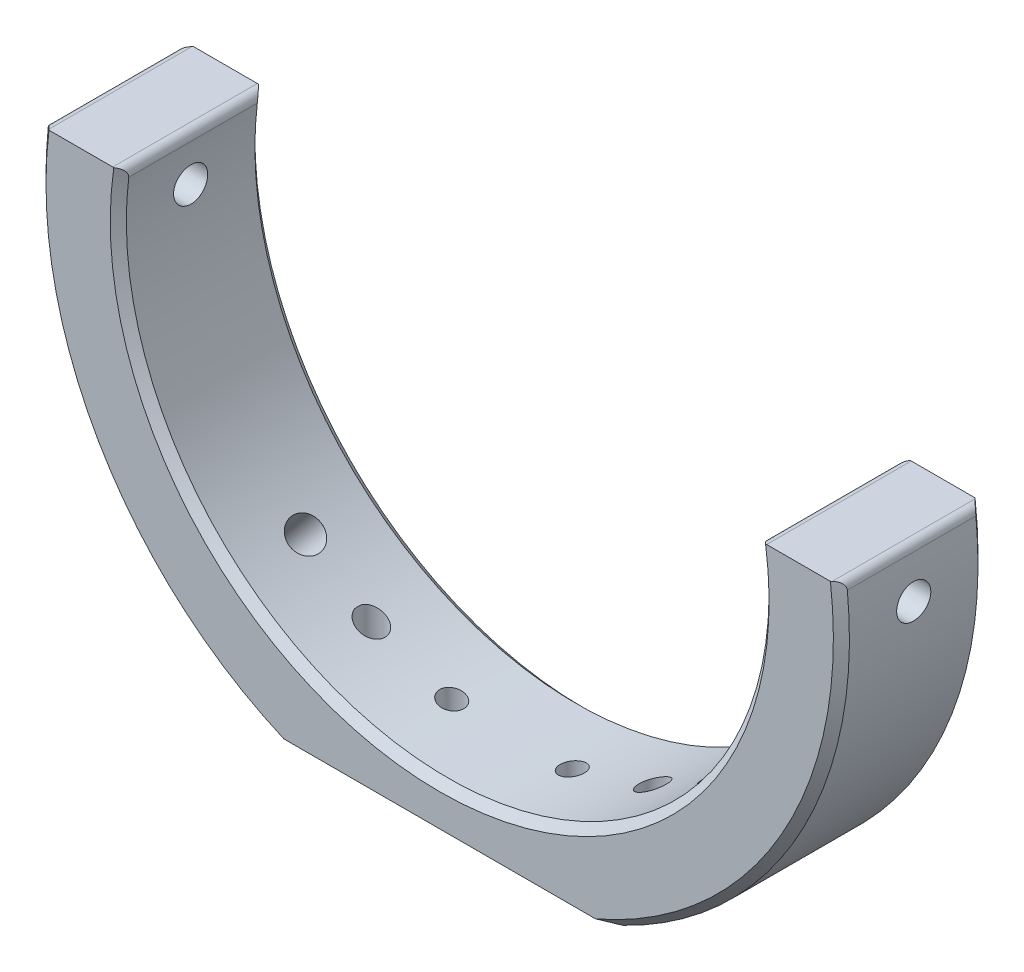
from build123d import *

# Parameters (mm, degrees)
SKETCH_1_R               = 100
SKETCH_1_R_2             = 80
EXTRUDE_1_DEPTH          = 36
CHAMFER_1_SIZE           = 2
CUT_EXTRUDE_1_DEPTH      = 146.931490776
CUT_EXTRUDE_1_DEPTH_BACK = 146.931490776
MM_1_D                   = 6
MM_1_DEPTH               = 19
MM_1_TIP                 = 1.802581857
HOLE_WIZARD_M8_1_D       = 6.8
HOLE_WIZARD_M8_1_DEPTH   = 19.75
HOLE_WIZARD_M8_1_TIP     = 2.042926105
PATTERN_CIRCULAR_1_COUNT = 4
PATTERN_CIRCULAR_1_ANGLE = 240
SKETCH_12_W              = 150
SKETCH_12_H              = 97.553227681
CUT_EXTRUDE_2_DEPTH      = 146.931490913
FILLET_1_R               = 5
HOLE_WIZARD_M10_2_D      = 8.5
SKETCH_15_W              = 235.919366165
SKETCH_15_H              = 63.632835437
CUT_EXTRUDE_3_DEPTH      = 140.269523031
FILLET_2_R               = 2


with BuildPart() as part:
    # 草图1 → 凸台-拉伸1 (new body)
    with BuildSketch(Plane.XY):
        Circle(SKETCH_1_R)
        Circle(SKETCH_1_R_2, mode=Mode.SUBTRACT)
    extrude(amount=EXTRUDE_1_DEPTH)

    # 倒角1
    chamfer_1_edges = [part.edges().sort_by_distance(p)[0] for p in [
        (-80, 0, 0),
        (-100, 0, 0),
        (-80, 0, 36),
        (-100, 0, 36),
    ]]
    chamfer(chamfer_1_edges, length=CHAMFER_1_SIZE)

    # 草图4 → 切除-拉伸1 (cut, two sides: drawn at the far end of the back side and taken through both)
    with BuildSketch(Plane.XY.offset(36).offset(-CUT_EXTRUDE_1_DEPTH_BACK)):
        Polygon((-671.32924466, -90), (-83.687890137, -90), (117.525593009, -90), (705.166947532, -90), (705.166947532, -1265.282709046), (-671.32924466, -1265.282709046), align=None)
    extrude(amount=CUT_EXTRUDE_1_DEPTH + CUT_EXTRUDE_1_DEPTH_BACK, mode=Mode.SUBTRACT)

    # 大小mm 暗销孔1
    with Locations(Plane(origin=(0, -90, 0), x_dir=(-1, 0, 0), z_dir=(0, -1, 0))):
        with Locations((15, -18), (-15, -18)):
            Hole(MM_1_D / 2, depth=MM_1_DEPTH)
            with Locations((0, 0, -(MM_1_DEPTH + MM_1_TIP / 2))):  # 118° drill point
                Cone(0, MM_1_D / 2, MM_1_TIP, mode=Mode.SUBTRACT)

    # M8 螺纹孔1
    with Locations(Plane(origin=(0, -90, 0), x_dir=(-1, 0, 0), z_dir=(0, -1, 0))):
        with Locations((35, -18), (-35, -18)):
            Hole(HOLE_WIZARD_M8_1_D / 2, depth=HOLE_WIZARD_M8_1_DEPTH)
            with Locations((0, 0, -(HOLE_WIZARD_M8_1_DEPTH + HOLE_WIZARD_M8_1_TIP / 2))):  # 118° drill point
                Cone(0, HOLE_WIZARD_M8_1_D / 2, HOLE_WIZARD_M8_1_TIP, mode=Mode.SUBTRACT)

    # 草图10 → M10 螺纹孔1 (revolve, cut)
    with BuildSketch(Plane(origin=(-103.923048454, 60, 18), x_dir=(-0.500000000000001, -0.866025403784438, 0), z_dir=(0, 0, 1))):
        Polygon((0, 0), (0, 42.553657631), (4.25, 40), (4.25, 0), align=None)
    hole_wizard_m10_1 = revolve(axis=Axis((-109.422309768, 63.175, 18), (0.866025403784438, -0.500000000000001, 0)), mode=Mode.SUBTRACT)

    # 阵列(圆周)1: M10 螺纹孔1 ×4 about axis
    pattern_circular_1_axis = Axis((0, 0, 36), (0, 0, 1))
    for i in range(1, PATTERN_CIRCULAR_1_COUNT):
        add(hole_wizard_m10_1.rotate(pattern_circular_1_axis, i * PATTERN_CIRCULAR_1_ANGLE / (PATTERN_CIRCULAR_1_COUNT - 1)), mode=Mode.SUBTRACT)

    # 草图12 → 切除-拉伸2 (cut, through all)
    with BuildSketch(Plane.XY.offset(36)):
        with Locations((0, 64.832996053)):
            Rectangle(SKETCH_12_W, SKETCH_12_H)
    extrude(amount=-CUT_EXTRUDE_2_DEPTH, mode=Mode.SUBTRACT)

    # 圆角1
    fillet_1_edges = [part.edges().sort_by_distance(p)[0] for p in [
        (-75, 66.143782777, 18),
        (75, 66.143782777, 18),
    ]]
    fillet(fillet_1_edges, radius=FILLET_1_R)

    # M10 螺纹孔2 (through all)
    with Locations(Plane(origin=(130, 0, 0), x_dir=(0, 0, -1), z_dir=(1, 0, 0))):
        with Locations((-18, 0)):
            Hole(HOLE_WIZARD_M10_2_D / 2)

    # 草图15 → 切除-拉伸3 (cut, through all)
    with BuildSketch(Plane.XY.offset(36)):
        with Locations((-11.05376348, 43.816417719)):
            Rectangle(SKETCH_15_W, SKETCH_15_H)
    extrude(amount=-CUT_EXTRUDE_3_DEPTH, mode=Mode.SUBTRACT)

    # 圆角2
    fillet_2_edges = [part.edges().sort_by_distance(p)[0] for p in [
        (99.277389168, 12, 18),
        (79.094879733, 12, 18),
        (-79.094879733, 12, 18),
        (-99.277389168, 12, 18),
    ]]
    fillet(fillet_2_edges, radius=FILLET_2_R)


solid = part.part
